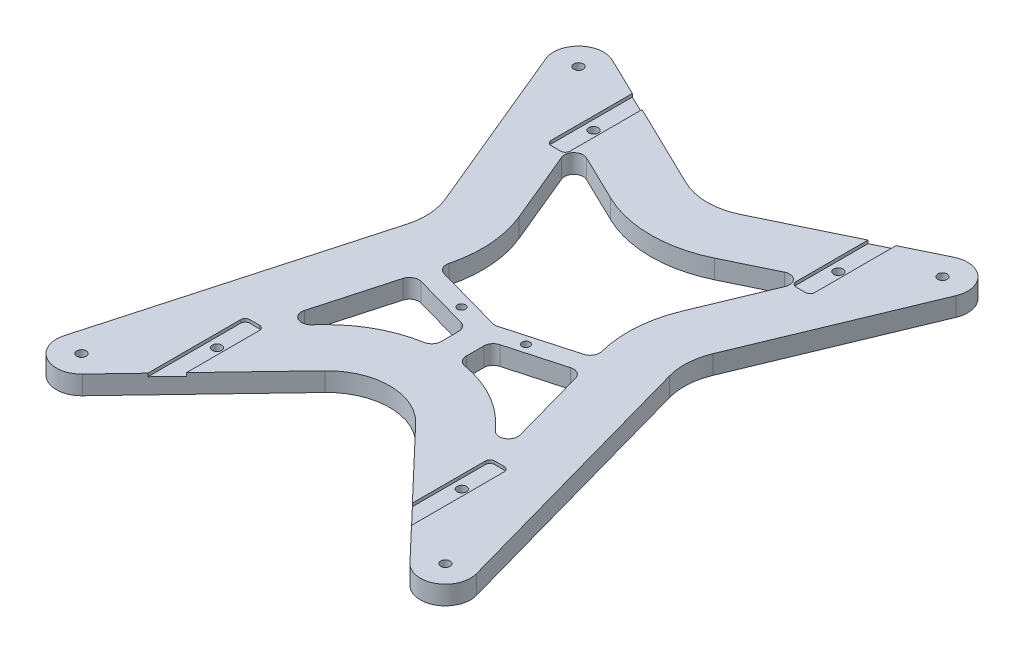
from build123d import *

# Parameters (mm, degrees)
SKETCH1_R           = 1.5
BOSS_EXTRUDE1_DEPTH = 6
FILLET1_R           = 20
CUT_EXTRUDE1_REACH  = 111.512
SKETCH5_R           = 1.25
BOSS_EXTRUDE2_DEPTH = 6
FILLET2_R           = 3
SKETCH6_W           = 6
SKETCH6_H           = 31.030846562
SKETCH6_H_2         = 27.343468982
CUT_EXTRUDE2_DEPTH  = 1
FILLET3_R           = 1.5


with BuildPart() as part:
    # Sketch1 → Boss-Extrude1 (new body)
    with BuildSketch(Plane(origin=(0, 0, 0), x_dir=(1, 0, 0), z_dir=(0, 1, 0))):
        with BuildLine():
            Line((-54.495367447, 86.395828983), (0, 60))
            Line((0, 60), (54.495367447, 86.395828983))
            ThreePointArc((54.495367447, 86.395828983), (63.474216903, 85.013506895), (65.371608634, 76.129225465))
            Line((65.371608634, 76.129225465), (40, 15))
            Line((40, 15), (65.688300647, -77.045475229))
            ThreePointArc((65.688300647, -77.045475229), (61.936793138, -86.150496915), (52.193978606, -84.717739607))
            Line((52.193978606, -84.717739607), (0, -30))
            Line((0, -30), (-52.193978606, -84.717739607))
            ThreePointArc((-52.193978606, -84.717739607), (-61.936793138, -86.150496915), (-65.688300647, -77.045475229))
            Line((-65.688300647, -77.045475229), (-40, 15))
            Line((-40, 15), (-65.371608634, 76.129225465))
            ThreePointArc((-65.371608634, 76.129225465), (-63.474216903, 85.013506895), (-54.495367447, 86.395828983))
        make_face()
        with Locations(Location((-57.982756057, 79.195959493, 0), (0, 0, 270))):
            Circle(SKETCH1_R, mode=Mode.SUBTRACT)
        with Locations(Location((57.982756057, 79.195959493, 0), (0, 0, 270))):
            Circle(SKETCH1_R, mode=Mode.SUBTRACT)
        with Locations(Location((-57.982756057, -79.195959493, 0), (0, 0, 270))):
            Circle(SKETCH1_R, mode=Mode.SUBTRACT)
        with Locations(Location((57.982756057, -79.195959493, 0), (0, 0, 270))):
            Circle(SKETCH1_R, mode=Mode.SUBTRACT)
        with Locations(Location((-39, 65, 0), (0, 0, 270))):
            Circle(SKETCH1_R, mode=Mode.SUBTRACT)
        with Locations(Location((39, 65, 0), (0, 0, 270))):
            Circle(SKETCH1_R, mode=Mode.SUBTRACT)
        with Locations(Location((39, -55, 0), (0, 0, 270))):
            Circle(SKETCH1_R, mode=Mode.SUBTRACT)
        with Locations(Location((-39, -55, 0), (0, 0, 270))):
            Circle(SKETCH1_R, mode=Mode.SUBTRACT)
    extrude(amount=BOSS_EXTRUDE1_DEPTH)

    # Fillet1
    fillet1_edges = [part.edges().sort_by_distance(p)[0] for p in [
        (0, 3, -60),
        (40, 3, -15),
        (0, 3, 30),
        (-40, 3, -15),
    ]]
    fillet(fillet1_edges, radius=FILLET1_R)

    # Sketch2 → Cut-Extrude1 (cut, up to next)
    with BuildSketch(Plane(origin=(0, 6, 0), x_dir=(1, 0, 0), z_dir=(0, 1, 0)), mode=Mode.PRIVATE) as cut_extrude1_sk1:
        with BuildLine():
            Line((-38.659149277, 58.724904233), (-26.025041931, 28.284847884))
            ThreePointArc((-26.025041931, 28.284847884), (-23.19190714, 16.020273346), (-24.520754868, 3.503060996))
            Line((-24.520754868, 3.503060996), (-37.591117294, -43.330232394))
            Line((-37.591117294, -43.330232394), (-27.496692892, -32.747707347))
            ThreePointArc((-27.496692892, -32.747707347), (0, -20.976162887), (27.496692892, -32.747707347))
            Line((27.496692892, -32.747707347), (37.591117294, -43.330232394))
            Line((37.591117294, -43.330232394), (24.520754868, 3.503060996))
            ThreePointArc((24.520754868, 3.503060996), (23.19190714, 16.020273346), (26.025041931, 28.284847884))
            Line((26.025041931, 28.284847884), (38.659149277, 58.724904233))
            Line((38.659149277, 58.724904233), (16.565095901, 48.023244958))
            ThreePointArc((16.565095901, 48.023244958), (0, 44.222625037), (-16.565095901, 48.023244958))
            Line((-16.565095901, 48.023244958), (-38.659149277, 58.724904233))
        make_face()
    cut_extrude1_tool1 = extrude(cut_extrude1_sk1.sketch, amount=-CUT_EXTRUDE1_REACH, mode=Mode.PRIVATE) & part.part
    add(cut_extrude1_tool1.solids().sort_by_distance((0, 6, -11.023996))[0], mode=Mode.SUBTRACT)

    # Sketch5 → Boss-Extrude2 (add)
    with BuildSketch(Plane(origin=(0, 6, 0), x_dir=(1, 0, 0), z_dir=(0, 1, 0))):
        with BuildLine():
            Line((-25.103227244, 1.415965109), (0, -5.589911573))
            Line((0, -5.589911573), (25.103227244, 1.415965109))
            Line((25.103227244, 1.415965109), (26.716090442, -4.363193333))
            Line((26.716090442, -4.363193333), (4, -10.702861409))
            Line((4, -10.702861409), (4, -21.187275631))
            ThreePointArc((4, -21.187275631), (0, -20.976162887), (-4, -21.187275631))
            Line((-4, -21.187275631), (-4, -10.702861409))
            Line((-4, -10.702861409), (-26.716090442, -4.363193333))
            Line((-26.716090442, -4.363193333), (-25.103227244, 1.415965109))
        make_face()
        with Locations(Location((-10.3, -5.83, 0), (0, 0, 270))):
            Circle(SKETCH5_R, mode=Mode.SUBTRACT)
        with Locations(Location((10.3, -5.83, 0), (0, 0, 270))):
            Circle(SKETCH5_R, mode=Mode.SUBTRACT)
    extrude(amount=-BOSS_EXTRUDE2_DEPTH)

    # Fillet2
    fillet2_edges = [part.edges().sort_by_distance(p)[0] for p in [
        (37.591117294, 3, 43.330232394),
        (-37.591117294, 3, 43.330232394),
        (38.659149277, 3, -58.724904233),
        (-38.659149277, 3, -58.724904233),
        (25.103227244, 3, -1.415965109),
        (-25.103227244, 3, -1.415965109),
        (0, 3, 5.589911573),
        (26.716090442, 3, 4.363193333),
        (4, 3, 10.702861409),
        (4, 3, 21.187275631),
        (-4, 3, 21.187275631),
        (-4, 3, 10.702861409),
        (-26.716090442, 3, 4.363193333),
    ]]
    fillet(fillet2_edges, radius=FILLET2_R)

    # Sketch6 → Cut-Extrude2 (cut)
    with BuildSketch(Plane(origin=(0, 6, 0), x_dir=(1, 0, 0), z_dir=(0, 1, 0))):
        with Locations((-39, -58.515423281)):
            Rectangle(SKETCH6_W, SKETCH6_H)
        with Locations((39, -58.515423281)):
            Rectangle(SKETCH6_W, SKETCH6_H)
        with Locations((39, 66.671734491)):
            Rectangle(SKETCH6_W, SKETCH6_H_2)
        with Locations((-39, 66.671734491)):
            Rectangle(SKETCH6_W, SKETCH6_H_2)
    extrude(amount=-CUT_EXTRUDE2_DEPTH, mode=Mode.SUBTRACT)

    # Fillet3
    fillet3_edges = [part.edges().sort_by_distance(p)[0] for p in [
        (-36, 5.5, 43),
        (-42, 5.5, 43),
        (36, 5.5, 43),
        (42, 5.5, 43),
        (36, 5.5, -53),
        (42, 5.5, -53),
        (-42, 5.5, -53),
        (-36, 5.5, -53),
    ]]
    fillet(fillet3_edges, radius=FILLET3_R)


solid = part.part
